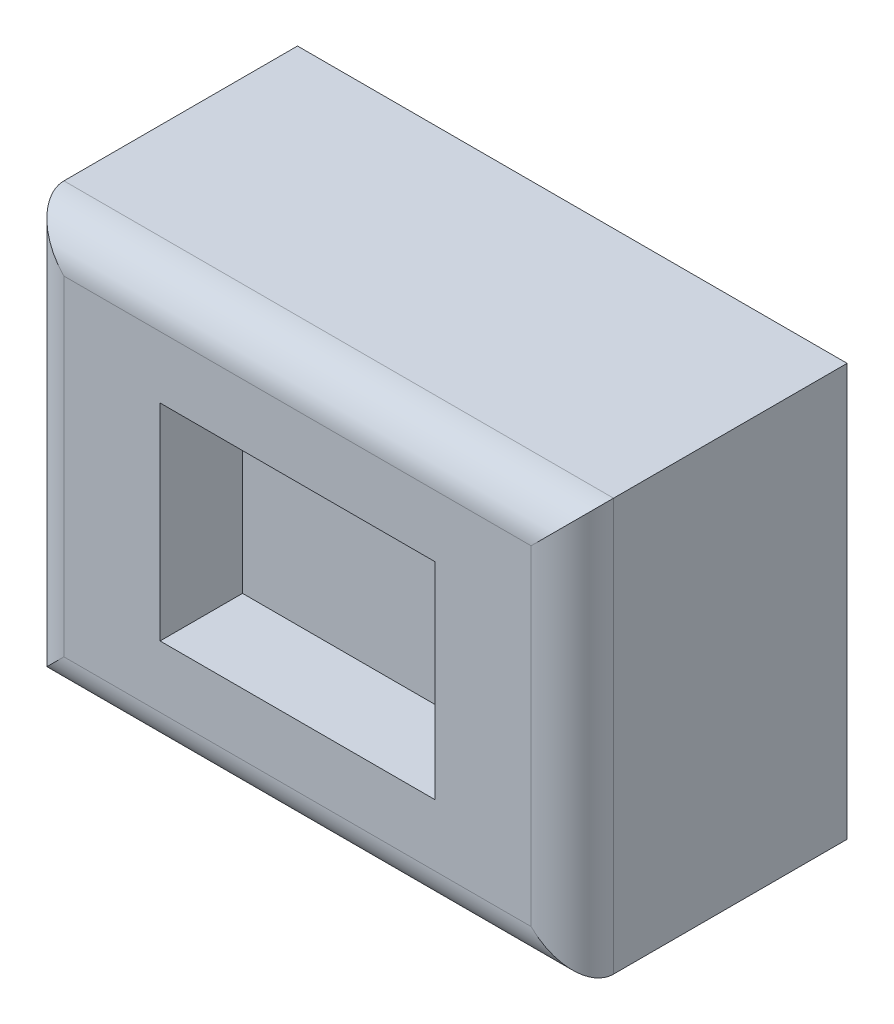
from build123d import *

# Parameters (mm, degrees)
SKETCH_1_W      = 40
SKETCH_1_H      = 30
M0_BOSS_DEPTH   = 20
SKETCH_2_W      = 20
SKETCH_2_H      = 15
M0_POCKET_DEPTH = 6
M0_TOPR3_R      = 3


with BuildPart() as part:
    # ｽｹｯﾁ1 → M0_Boss (new body)
    with BuildSketch(Plane.XY):
        Rectangle(SKETCH_1_W, SKETCH_1_H)
    extrude(amount=M0_BOSS_DEPTH)

    # ｽｹｯﾁ2 → M0_Pocket (cut)
    with BuildSketch(Plane.XY.offset(20)):
        Rectangle(SKETCH_2_W, SKETCH_2_H)
    extrude(amount=-M0_POCKET_DEPTH, mode=Mode.SUBTRACT)

    # M0_TopR3
    m0_topr3_edges = [part.edges().sort_by_distance(p)[0] for p in [
        (20, 0, 20),
        (0, 15, 20),
        (-20, 0, 20),
        (0, -15, 20),
    ]]
    fillet(m0_topr3_edges, radius=M0_TOPR3_R)


solid = part.part
